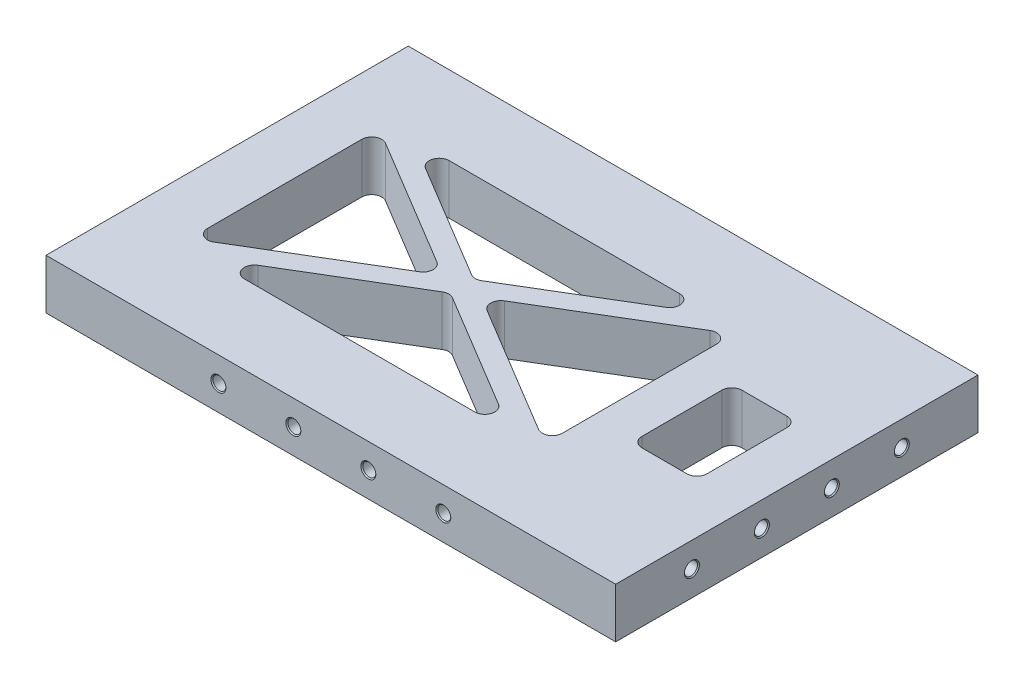
from build123d import *

# Parameters (mm, degrees)
SKETCH_1_W               = 114
SKETCH_1_H               = 72.5
EXTRUDE_1_DEPTH          = 10
SKETCH_2_R               = 1.3
CUT_EXTRUDE_1_DEPTH      = 8
PATTERN_LINEAR_1_COUNT   = 4
PATTERN_LINEAR_1_PITCH   = 15
MIRROR_1_COPY_1_SKETCH_R = 1.3
MIRROR_1_COPY_1_DEPTH    = 8
MIRROR_1_COPY_2_SKETCH_R = 1.3
MIRROR_1_COPY_2_DEPTH    = 8
MIRROR_1_COPY_3_SKETCH_R = 1.3
MIRROR_1_COPY_3_DEPTH    = 8
SKETCH_3_R               = 1.3
CUT_EXTRUDE_2_DEPTH      = 7.5
PATTERN_LINEAR_2_COUNT   = 4
PATTERN_LINEAR_2_PITCH   = 14
MIRROR_2_COPY_1_SKETCH_R = 1.3
MIRROR_2_COPY_1_DEPTH    = 7.5
MIRROR_2_COPY_2_SKETCH_R = 1.3
MIRROR_2_COPY_2_DEPTH    = 7.5
MIRROR_2_COPY_3_SKETCH_R = 1.3
MIRROR_2_COPY_3_DEPTH    = 7.5
CUT_EXTRUDE_3_REACH      = 70.287
SKETCH_4_W               = 13
SKETCH_4_H               = 20
FILLET_1_R               = 2
CHAMFER_1_SIZE           = 0.2


with BuildPart() as part:
    # 草圖1 → 填料-伸長1 (new body)
    with BuildSketch(Plane(origin=(0, 0, 0), x_dir=(1, 0, 0), z_dir=(0, 1, 0))):
        Rectangle(SKETCH_1_W, SKETCH_1_H)
    extrude(amount=EXTRUDE_1_DEPTH)

    # 草圖2 → 除料-伸長1 (cut)
    with BuildSketch(Plane.XY.offset(36.25)):
        with Locations((-22.5, 5)):
            Circle(SKETCH_2_R)
    cut_extrude_1 = extrude(amount=-CUT_EXTRUDE_1_DEPTH, mode=Mode.SUBTRACT)

    # 直線複製排列1: 除料-伸長1 ×4
    with Locations(*[(i * PATTERN_LINEAR_1_PITCH, 0, 0) for i in range(1, PATTERN_LINEAR_1_COUNT)]):
        add(cut_extrude_1, mode=Mode.SUBTRACT)

    # 鏡射1: 除料-伸長1 across plane
    add(cut_extrude_1.mirror(Plane.XY), mode=Mode.SUBTRACT)

    # 鏡射1 copy 1 sketch → 鏡射1 copy 1 (cut)
    with BuildSketch(Plane(origin=(15, 0, -36.25), x_dir=(1, 0, 0), z_dir=(0, 0, -1))):
        with Locations((-22.5, -5)):
            Circle(MIRROR_1_COPY_1_SKETCH_R)
    extrude(amount=-MIRROR_1_COPY_1_DEPTH, mode=Mode.SUBTRACT)

    # 鏡射1 copy 2 sketch → 鏡射1 copy 2 (cut)
    with BuildSketch(Plane(origin=(30, 0, -36.25), x_dir=(1, 0, 0), z_dir=(0, 0, -1))):
        with Locations((-22.5, -5)):
            Circle(MIRROR_1_COPY_2_SKETCH_R)
    extrude(amount=-MIRROR_1_COPY_2_DEPTH, mode=Mode.SUBTRACT)

    # 鏡射1 copy 3 sketch → 鏡射1 copy 3 (cut)
    with BuildSketch(Plane(origin=(45, 0, -36.25), x_dir=(1, 0, 0), z_dir=(0, 0, -1))):
        with Locations((-22.5, -5)):
            Circle(MIRROR_1_COPY_3_SKETCH_R)
    extrude(amount=-MIRROR_1_COPY_3_DEPTH, mode=Mode.SUBTRACT)

    # 草圖3 → 除料-伸長2 (cut)
    with BuildSketch(Plane.ZY.offset(57)):
        with Locations((-21, 5)):
            Circle(SKETCH_3_R)
    cut_extrude_2 = extrude(amount=-CUT_EXTRUDE_2_DEPTH, mode=Mode.SUBTRACT)

    # 直線複製排列2: 除料-伸長2 ×4
    with Locations(*[(0, 0, i * PATTERN_LINEAR_2_PITCH) for i in range(1, PATTERN_LINEAR_2_COUNT)]):
        add(cut_extrude_2, mode=Mode.SUBTRACT)

    # 鏡射2: 除料-伸長2 across plane
    add(cut_extrude_2.mirror(Plane(origin=(0, 0, 0), x_dir=(0, 0, 1), z_dir=(1, 0, 0))), mode=Mode.SUBTRACT)

    # 鏡射2 copy 1 sketch → 鏡射2 copy 1 (cut)
    with BuildSketch(Plane(origin=(57, 0, 14), x_dir=(0, 0, 1), z_dir=(1, 0, 0))):
        with Locations((-21, -5)):
            Circle(MIRROR_2_COPY_1_SKETCH_R)
    extrude(amount=-MIRROR_2_COPY_1_DEPTH, mode=Mode.SUBTRACT)

    # 鏡射2 copy 2 sketch → 鏡射2 copy 2 (cut)
    with BuildSketch(Plane(origin=(57, 0, 28), x_dir=(0, 0, 1), z_dir=(1, 0, 0))):
        with Locations((-21, -5)):
            Circle(MIRROR_2_COPY_2_SKETCH_R)
    extrude(amount=-MIRROR_2_COPY_2_DEPTH, mode=Mode.SUBTRACT)

    # 鏡射2 copy 3 sketch → 鏡射2 copy 3 (cut)
    with BuildSketch(Plane(origin=(57, 0, 42), x_dir=(0, 0, 1), z_dir=(1, 0, 0))):
        with Locations((-21, -5)):
            Circle(MIRROR_2_COPY_3_SKETCH_R)
    extrude(amount=-MIRROR_2_COPY_3_DEPTH, mode=Mode.SUBTRACT)

    # 草圖4 → 除料-伸長3 (cut, up to next)
    with BuildSketch(Plane(origin=(0, 10, 0), x_dir=(1, 0, 0), z_dir=(0, 1, 0)), mode=Mode.PRIVATE) as cut_extrude_3_sk1:
        Polygon((-45.5, 18.967619242), (-45.5, -18.967619242), (-13.887301263, 0), align=None)
    cut_extrude_3_tool1 = extrude(cut_extrude_3_sk1.sketch, amount=-CUT_EXTRUDE_3_REACH, mode=Mode.PRIVATE) & part.part
    # 草圖4 → 除料-伸長3 (cut, up to next)
    with BuildSketch(Plane(origin=(0, 10, 0), x_dir=(1, 0, 0), z_dir=(0, 1, 0)), mode=Mode.PRIVATE) as cut_extrude_3_sk2:
        Polygon((-40.279365403, 20.5), (-10, 2.332380758), (20.279365403, 20.5), align=None)
    cut_extrude_3_tool2 = extrude(cut_extrude_3_sk2.sketch, amount=-CUT_EXTRUDE_3_REACH, mode=Mode.PRIVATE) & part.part
    # 草圖4 → 除料-伸長3 (cut, up to next)
    with BuildSketch(Plane(origin=(0, 10, 0), x_dir=(1, 0, 0), z_dir=(0, 1, 0)), mode=Mode.PRIVATE) as cut_extrude_3_sk3:
        Polygon((-6.112698737, 0), (25.5, 18.967619242), (25.5, -18.967619242), align=None)
    cut_extrude_3_tool3 = extrude(cut_extrude_3_sk3.sketch, amount=-CUT_EXTRUDE_3_REACH, mode=Mode.PRIVATE) & part.part
    # 草圖4 → 除料-伸長3 (cut, up to next)
    with BuildSketch(Plane(origin=(0, 10, 0), x_dir=(1, 0, 0), z_dir=(0, 1, 0)), mode=Mode.PRIVATE) as cut_extrude_3_sk4:
        Polygon((-10, -2.332380758), (20.279365403, -20.5), (-40.279365403, -20.5), align=None)
    cut_extrude_3_tool4 = extrude(cut_extrude_3_sk4.sketch, amount=-CUT_EXTRUDE_3_REACH, mode=Mode.PRIVATE) & part.part
    # 草圖4 → 除料-伸長3 (cut, up to next)
    with BuildSketch(Plane(origin=(0, 10, 0), x_dir=(1, 0, 0), z_dir=(0, 1, 0)), mode=Mode.PRIVATE) as cut_extrude_3_sk5:
        with Locations((40.5, 0)):
            Rectangle(SKETCH_4_W, SKETCH_4_H)
    cut_extrude_3_tool5 = extrude(cut_extrude_3_sk5.sketch, amount=-CUT_EXTRUDE_3_REACH, mode=Mode.PRIVATE) & part.part
    add(cut_extrude_3_tool1.solids().sort_by_distance((-34.962434, 10, 0))[0], mode=Mode.SUBTRACT)
    add(cut_extrude_3_tool2.solids().sort_by_distance((-10, 10, -14.444127))[0], mode=Mode.SUBTRACT)
    add(cut_extrude_3_tool3.solids().sort_by_distance((14.962434, 10, 0))[0], mode=Mode.SUBTRACT)
    add(cut_extrude_3_tool4.solids().sort_by_distance((-10, 10, 14.444127))[0], mode=Mode.SUBTRACT)
    add(cut_extrude_3_tool5.solids().sort_by_distance((40.5, 10, 0))[0], mode=Mode.SUBTRACT)

    # 圓角1
    fillet_1_edges = [part.edges().sort_by_distance(p)[0] for p in [
        (-45.5, 5, 18.967619242),
        (-45.5, 5, -18.967619242),
        (-13.887301263, 5, 0),
        (-6.112698737, 5, 0),
        (25.5, 5, -18.967619242),
        (25.5, 5, 18.967619242),
        (-10, 5, -2.332380758),
        (-40.279365403, 5, -20.5),
        (20.279365403, 5, -20.5),
        (-10, 5, 2.332380758),
        (20.279365403, 5, 20.5),
        (-40.279365403, 5, 20.5),
        (47, 5, -10),
        (47, 5, 10),
        (34, 5, 10),
        (34, 5, -10),
    ]]
    fillet(fillet_1_edges, radius=FILLET_1_R)

    # 導角1
    chamfer_1_edges = [part.edges().sort_by_distance(p)[0] for p in [
        (-23.8, 5, 36.25),
        (-8.8, 5, 36.25),
        (6.2, 5, 36.25),
        (21.2, 5, 36.25),
        (-23.8, 5, -36.25),
        (-8.8, 5, -36.25),
        (6.2, 5, -36.25),
        (21.2, 5, -36.25),
        (-57, 5, -22.3),
        (-57, 5, -8.3),
        (-57, 5, 5.7),
        (-57, 5, 19.7),
        (57, 5, -22.3),
        (57, 5, -8.3),
        (57, 5, 5.7),
        (57, 5, 19.7),
    ]]
    chamfer(chamfer_1_edges, length=CHAMFER_1_SIZE)


solid = part.part
